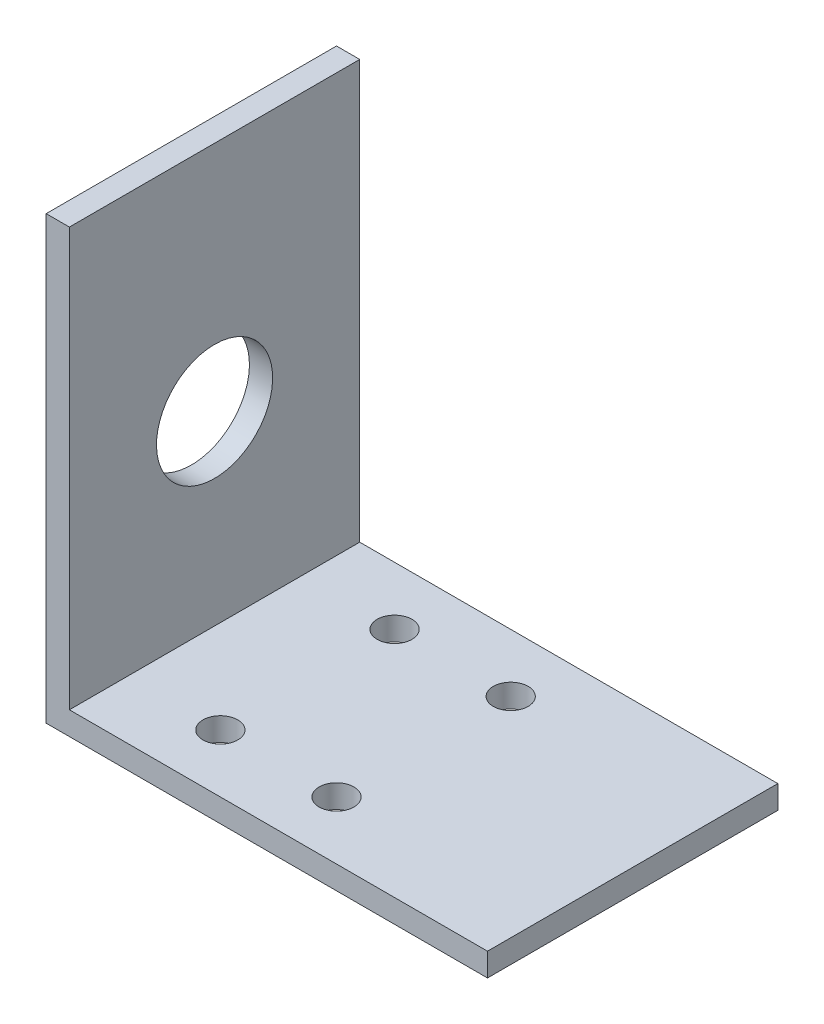
from build123d import *

# Parameters (mm, degrees)
EXTRUDE_1_DEPTH     = 25
SKETCH_2_R          = 1.5
CUT_EXTRUDE_1_DEPTH = 52.203275929
SKETCH_3_R          = 5
CUT_EXTRUDE_2_DEPTH = 48.891361585


with BuildPart() as part:
    # 草图1 → 凸台-拉伸1 (new body)
    with BuildSketch(Plane.XY):
        Polygon((-11.527836019, 18.697603401), (-11.527836019, -19.302396599), (26.472163981, -19.302396599), (26.472163981, -17.302396599), (-9.527836019, -17.302396599), (-9.527836019, 18.697603401), align=None)
    extrude(amount=EXTRUDE_1_DEPTH)

    # 草图2 → 切除-拉伸1 (cut, through all)
    with BuildSketch(Plane(origin=(0, -17.302396599, 0), x_dir=(1, 0, 0), z_dir=(0, 1, 0))):
        with Locations(Location((-1.527836019, -5, 0), (0, 0, 180))):
            Circle(SKETCH_2_R)
        with Locations(Location((8.472163981, -5, 0), (0, 0, 180))):
            Circle(SKETCH_2_R)
        with Locations(Location((8.472163981, -20, 0), (0, 0, 180))):
            Circle(SKETCH_2_R)
        with Locations(Location((-1.527836019, -20, 0), (0, 0, 180))):
            Circle(SKETCH_2_R)
    extrude(amount=-CUT_EXTRUDE_1_DEPTH, mode=Mode.SUBTRACT)

    # 草图3 → 切除-拉伸2 (cut, through all)
    with BuildSketch(Plane(origin=(-9.527836019, 0, 0), x_dir=(0, 0, -1), z_dir=(1, 0, 0))):
        with Locations(Location((-12.5, -1.302396599, 0), (0, 0, 90))):
            Circle(SKETCH_3_R)
    extrude(amount=-CUT_EXTRUDE_2_DEPTH, mode=Mode.SUBTRACT)


solid = part.part
